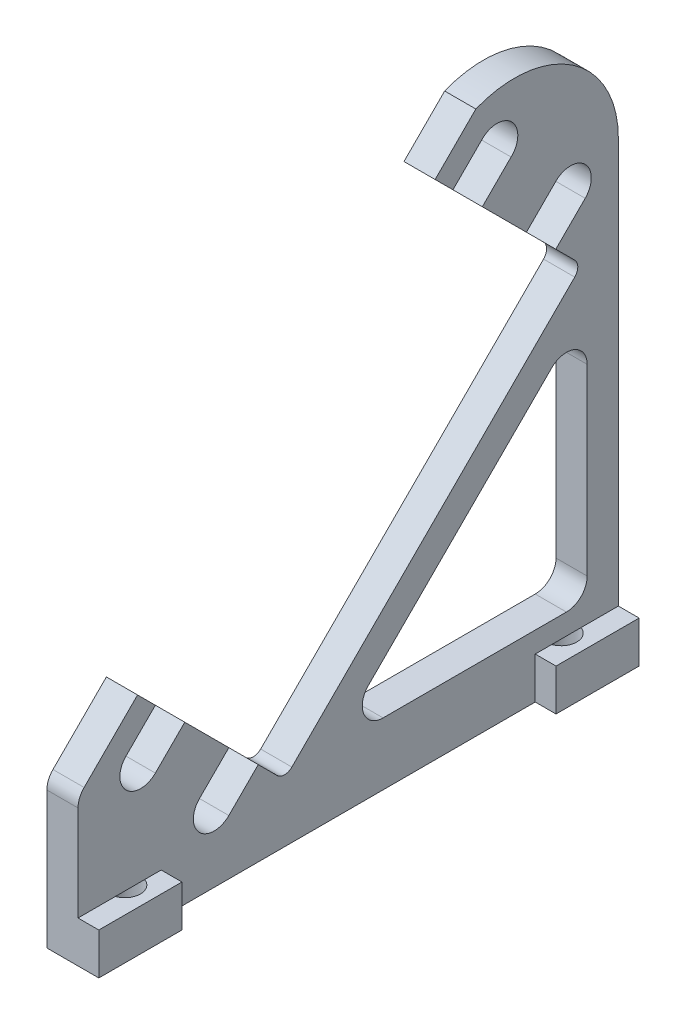
from build123d import *

# Parameters (mm, degrees)
EXTRUDE_1_DEPTH     = 5
CUT_EXTRUDE_1_DEPTH = 2
SKETCH_3_R          = 1.5
CUT_EXTRUDE_2_DEPTH = 4


with BuildPart() as part:
    # 草图1 → 凸台-拉伸1 (new body)
    with BuildSketch(Plane(origin=(0, 0, 0), x_dir=(0, 0, -1), z_dir=(1, 0, 0))):
        with BuildLine():
            Line((-52, 0), (0, 0))
            Line((0, 0), (0, 43))
            ThreePointArc((0, 43), (-4.394697965, 51.281339813), (-13.716117819, 52.283882181))
            Line((-13.716117819, 52.283882181), (-17.633748237, 48.366251763))
            Line((-17.633748237, 48.366251763), (-15.919029611, 46.651533137))
            Line((-15.919029611, 46.651533137), (-13.090602487, 49.479960262))
            ThreePointArc((-13.090602487, 49.479960262), (-10.294122713, 49.511201687), (-10.200414032, 46.716117819))
            ThreePointArc((-10.200414032, 46.716117819), (-10.262117257, 46.651591245), (-10.32663876, 46.589882717))
            Line((-10.32663876, 46.589882717), (-13.091895354, 43.824398879))
            Line((-13.091895354, 43.824398879), (-8.8479618, 39.580465325))
            Line((-8.8479618, 39.580465325), (-6.019534675, 42.40889245))
            ThreePointArc((-6.019534675, 42.40889245), (-3.19110755, 42.40889245), (-3.19110755, 39.580465325))
            Line((-3.19110755, 39.580465325), (-6.019534675, 36.7520382))
            Line((-6.019534675, 36.7520382), (-4.198719395, 34.93122292))
            ThreePointArc((-4.198719395, 34.93122292), (-3.905826176, 34.224116139), (-4.198719395, 33.517009358))
            Line((-4.198719395, 33.517009358), (-31.42233047, 6.293398282))
            ThreePointArc((-31.42233047, 6.293398282), (-32.129437252, 6.000505063), (-32.836544033, 6.293398282))
            Line((-32.836544033, 6.293398282), (-34.657359313, 8.114213562))
            Line((-34.657359313, 8.114213562), (-37.485786438, 5.285786438))
            ThreePointArc((-37.485786438, 5.285786438), (-40.314213562, 5.285786438), (-40.314213562, 8.114213562))
            Line((-40.314213562, 8.114213562), (-37.485786438, 10.942640687))
            Line((-37.485786438, 10.942640687), (-41.728543336, 15.185397586))
            Line((-41.728543336, 15.185397586), (-44.556796144, 12.356912357))
            ThreePointArc((-44.556796144, 12.356912357), (-47.385252321, 12.356825197), (-47.385281374, 15.185281374))
            Line((-47.385281374, 15.185281374), (-44.556854249, 18.013708499))
            Line((-44.556854249, 18.013708499), (-46.271572875, 19.728427125))
            Line((-46.271572875, 19.728427125), (-51.414213562, 14.585786438))
            ThreePointArc((-51.414213562, 14.585786438), (-51.847759065, 13.93693974), (-52, 13.171572875))
            Line((-52, 13.171572875), (-52, 0))
        make_face()
        with BuildLine():
            Line((-24.058874503, 9.414213562), (-6.414213562, 27.058874503))
            ThreePointArc((-6.414213562, 27.058874503), (-4.234633135, 27.492420006), (-3, 25.644660941))
            Line((-3, 25.644660941), (-3, 8))
            ThreePointArc((-3, 8), (-3.585786438, 6.585786438), (-5, 6))
            Line((-5, 6), (-22.644660941, 6))
            ThreePointArc((-22.644660941, 6), (-24.492420006, 7.234633135), (-24.058874503, 9.414213562))
        make_face(mode=Mode.SUBTRACT)
    extrude(amount=EXTRUDE_1_DEPTH)

    # 草图2 → 切除-拉伸1 (cut)
    with BuildSketch(Plane(origin=(5, 0, 0), x_dir=(0, 0, -1), z_dir=(1, 0, 0))):
        Polygon((9.286430281, 4), (-8, 4), (-8, -3.732330809), (-44, -3.732330809), (-44, 4), (-56.622484713, 4), (-56.622484713, 58.494521895), (9.286430281, 58.494521895), align=None)
    extrude(amount=-CUT_EXTRUDE_1_DEPTH, mode=Mode.SUBTRACT)

    # 草图3 → 切除-拉伸2 (cut)
    with BuildSketch(Plane.XZ):
        with Locations(Location((2.5, 47, 0), (0, 0, 270))):
            Circle(SKETCH_3_R)
        with Locations(Location((2.5, 5, 0), (0, 0, 270))):
            Circle(SKETCH_3_R)
    extrude(amount=-CUT_EXTRUDE_2_DEPTH, mode=Mode.SUBTRACT)


solid = part.part
